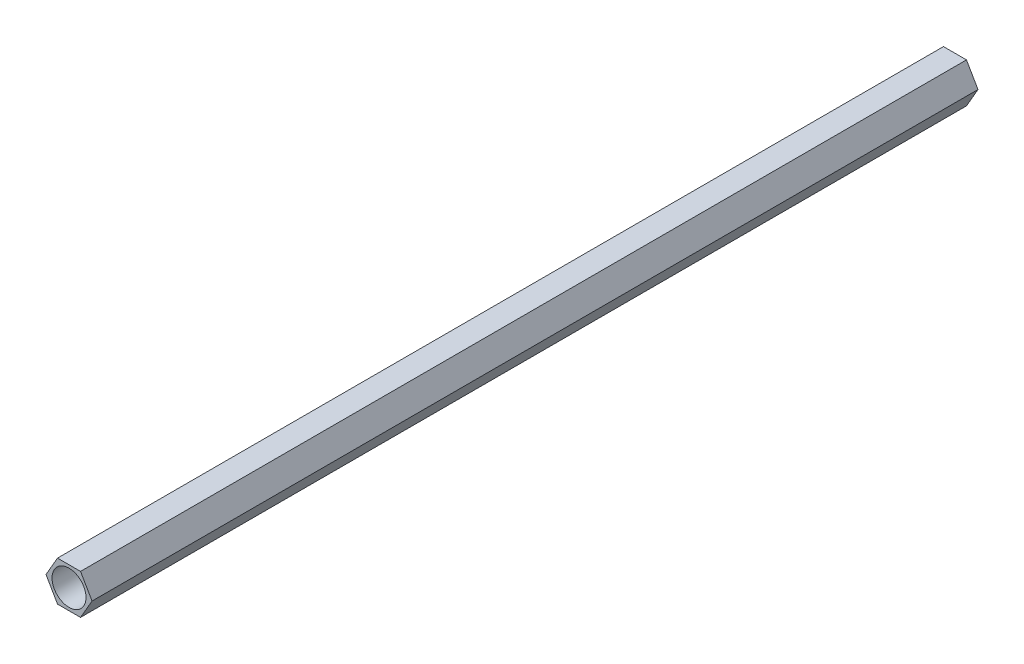
from build123d import *

# Parameters (mm, degrees)
SKETCH_1_R      = 1.917144679
EXTRUDE_1_DEPTH = 100


with BuildPart() as part:
    # 草图1 → 凸台-拉伸1 (new body)
    with BuildSketch(Plane.XY):
        Polygon((2.598076211, 0), (1.299038106, 2.25), (-1.299038106, 2.25), (-2.598076211, 0), (-1.299038106, -2.25), (1.299038106, -2.25), align=None)
        Circle(SKETCH_1_R, mode=Mode.SUBTRACT)
    extrude(amount=EXTRUDE_1_DEPTH)


solid = part.part
